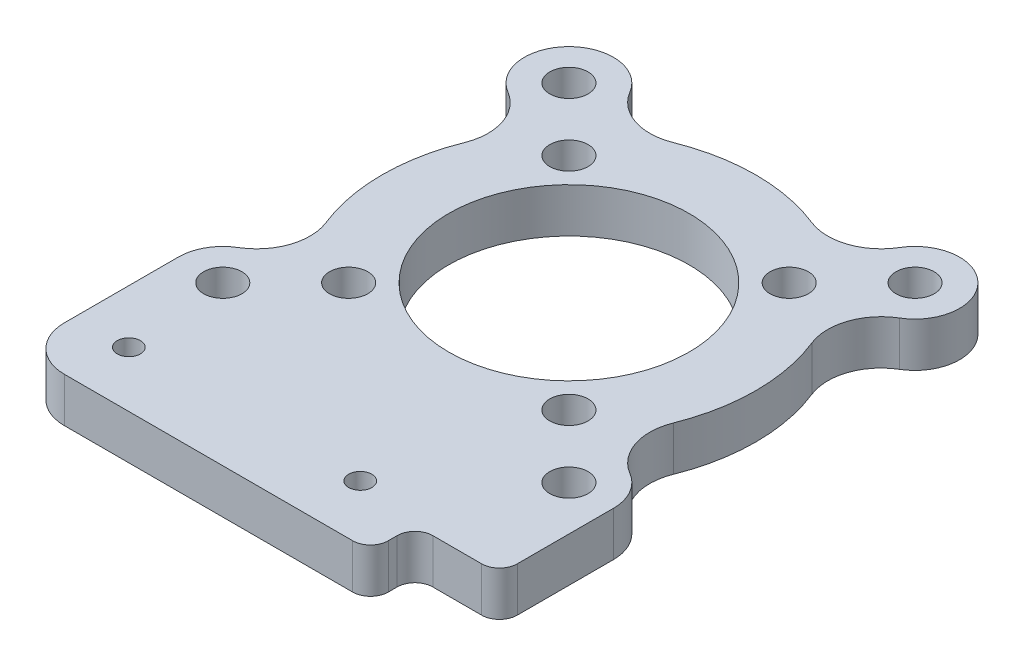
from build123d import *

# Parameters (mm, degrees)
SKETCH_1_R      = 13.5
SKETCH_1_R_2    = 2.15
SKETCH_1_R_3    = 1.3
EXTRUDE_1_DEPTH = 5
FILLET_1_R      = 2


with BuildPart() as part:
    # ｽｹｯﾁ1 → ﾎﾞｽ - 押し出し1 (new body)
    with BuildSketch(Plane(origin=(0, 0, 0), x_dir=(1, 0, 0), z_dir=(0, 1, 0))):
        with BuildLine():
            Line((-24.445436483, -32.25), (-24.445436483, -19.445436483))
            ThreePointArc((-24.445436483, -19.445436483), (-23.793249982, -16.976323733), (-22.006829374, -15.151339784))
            ThreePointArc((-22.006829374, -15.151339784), (-19.398069264, -11.924552334), (-19.507056212, -7.776551803))
            ThreePointArc((-19.507056212, -7.776551803), (-21, 0), (-19.507056212, 7.776551803))
            ThreePointArc((-19.507056212, 7.776551803), (-19.398069264, 11.924552334), (-22.006829374, 15.151339784))
            ThreePointArc((-22.006829374, 15.151339784), (-22.980970389, 22.980970389), (-15.151339784, 22.006829374))
            ThreePointArc((-15.151339784, 22.006829374), (-11.924552334, 19.398069264), (-7.776551803, 19.507056212))
            ThreePointArc((-7.776551803, 19.507056212), (0, 21), (7.776551803, 19.507056212))
            ThreePointArc((7.776551803, 19.507056212), (11.924552334, 19.398069264), (15.151339784, 22.006829374))
            ThreePointArc((15.151339784, 22.006829374), (22.980970389, 22.980970389), (22.006829374, 15.151339784))
            ThreePointArc((22.006829374, 15.151339784), (19.398069264, 11.924552334), (19.507056212, 7.776551803))
            ThreePointArc((19.507056212, 7.776551803), (21, 0), (19.507056212, -7.776551803))
            ThreePointArc((19.507056212, -7.776551803), (19.398069264, -11.924552334), (22.006829374, -15.151339784))
            ThreePointArc((22.006829374, -15.151339784), (23.793249982, -16.976323733), (24.445436483, -19.445436483))
            Line((24.445436483, -19.445436483), (24.445436483, -32.25))
            Line((24.445436483, -32.25), (14.953214466, -32.25))
            Line((14.953214466, -32.25), (14.953214466, -37.25))
            Line((14.953214466, -37.25), (-19.445436483, -37.25))
            ThreePointArc((-19.445436483, -37.25), (-22.980970389, -35.785533906), (-24.445436483, -32.25))
        make_face()
        with Locations(Location((0, 0, 0), (0, 0, 270))):
            Circle(SKETCH_1_R, mode=Mode.SUBTRACT)
        with Locations(Location((12.374368671, 12.374368671, 0), (0, 0, 270))):
            Circle(SKETCH_1_R_2, mode=Mode.SUBTRACT)
        with Locations(Location((12.374368671, -12.374368671, 0), (0, 0, 270))):
            Circle(SKETCH_1_R_2, mode=Mode.SUBTRACT)
        with Locations(Location((-12.374368671, -12.374368671, 0), (0, 0, 270))):
            Circle(SKETCH_1_R_2, mode=Mode.SUBTRACT)
        with Locations(Location((-12.374368671, 12.374368671, 0), (0, 0, 270))):
            Circle(SKETCH_1_R_2, mode=Mode.SUBTRACT)
        with Locations(Location((19.445436483, 19.445436483, 0), (0, 0, 270))):
            Circle(SKETCH_1_R_2, mode=Mode.SUBTRACT)
        with Locations(Location((19.445436483, -19.445436483, 0), (0, 0, 270))):
            Circle(SKETCH_1_R_2, mode=Mode.SUBTRACT)
        with Locations(Location((-19.445436483, -19.445436483, 0), (0, 0, 270))):
            Circle(SKETCH_1_R_2, mode=Mode.SUBTRACT)
        with Locations(Location((-19.445436483, 19.445436483, 0), (0, 0, 270))):
            Circle(SKETCH_1_R_2, mode=Mode.SUBTRACT)
        with Locations(Location((7.554563517, -31, 0), (0, 0, 270))):
            Circle(SKETCH_1_R_3, mode=Mode.SUBTRACT)
        with Locations(Location((-18.445436483, -31, 0), (0, 0, 270))):
            Circle(SKETCH_1_R_3, mode=Mode.SUBTRACT)
    extrude(amount=EXTRUDE_1_DEPTH)

    # ﾌｨﾚｯﾄ1
    fillet_1_edges = [part.edges().sort_by_distance(p)[0] for p in [
        (24.445436483, 2.5, 32.25),
        (14.953214466, 2.5, 32.25),
        (14.953214466, 2.5, 37.25),
    ]]
    fillet(fillet_1_edges, radius=FILLET_1_R)


solid = part.part
